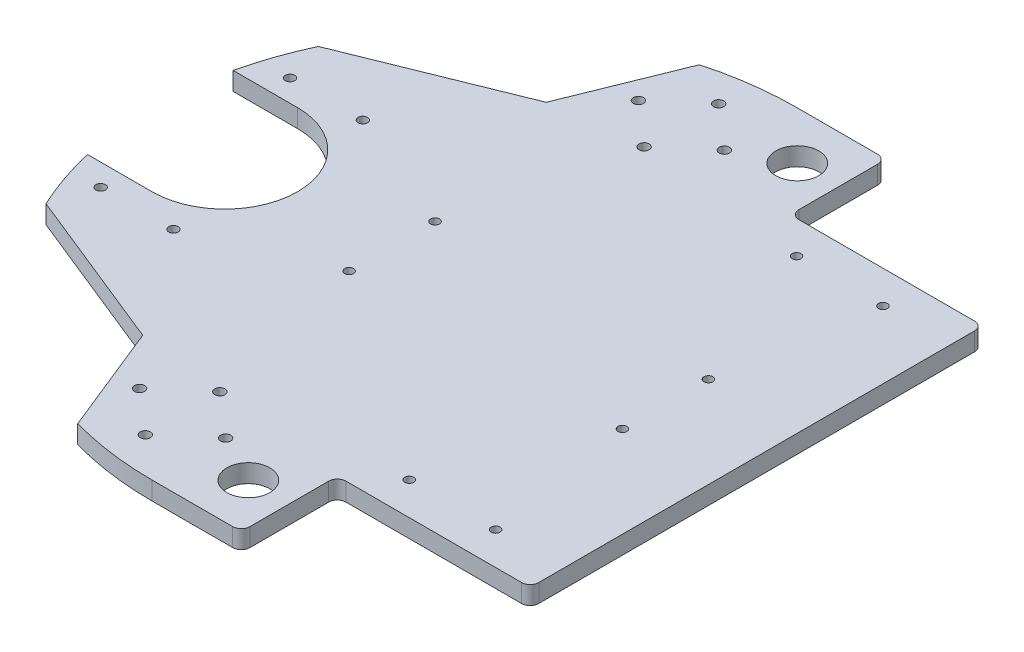
from build123d import *

# Parameters (mm, degrees)
BOSS_EXTRUDE1_DEPTH = 6.35
SKETCH8_R           = 1.651
CUT_EXTRUDE5_DEPTH  = 162.484606465
CUT_EXTRUDE6_DEPTH  = 160.416662013
SKETCH16_R          = 1.775
CUT_EXTRUDE9_DEPTH  = 160.416662013
SKETCH17_R          = 1.55
SKETCH17_R_2        = 7.5
SKETCH17_W          = 67.26995632
SKETCH17_H          = 33.5
CUT_EXTRUDE10_DEPTH = 160.416662013
FILLET1_R           = 3
SKETCH18_R          = 1.55
CUT_EXTRUDE11_DEPTH = 160.416662013


with BuildPart() as part:
    # Sketch1 → Boss-Extrude1 (new body)
    with BuildSketch(Plane(origin=(0, 0, 0), x_dir=(1, 0, 0), z_dir=(0, 1, 0))):
        with BuildLine():
            Line((-3.175, 112.5), (95.25, 112.5))
            Line((95.25, 112.5), (95.25, -112.5))
            Line((95.25, -112.5), (-3.175, -112.5))
            ThreePointArc((-3.175, -112.5), (-115.675, 0), (-3.175, 112.5))
        make_face()
    extrude(amount=-BOSS_EXTRUDE1_DEPTH)

    # Sketch8 → Cut-Extrude5 (cut, through all)
    with BuildSketch(Plane(origin=(0, 0, 0), x_dir=(1, 0, 0), z_dir=(0, 1, 0))):
        with Locations(Location((-100.5586, 33.02, 0), (0, 0, 270))):
            Circle(SKETCH8_R)
        with Locations(Location((-100.5586, -33.02, 0), (0, 0, 270))):
            Circle(SKETCH8_R)
        with Locations(Location((-75.1586, 33.02, 0), (0, 0, 270))):
            Circle(SKETCH8_R)
        with Locations(Location((-75.1586, -33.02, 0), (0, 0, 270))):
            Circle(SKETCH8_R)
        with BuildLine():
            Line((-90.2716, 25.4), (-229.776686608, 25.4))
            Line((-229.776686608, 25.4), (-229.776686608, -25.4))
            Line((-229.776686608, -25.4), (-90.2716, -25.4))
            ThreePointArc((-90.2716, -25.4), (-64.8716, 0), (-90.2716, 25.4))
        make_face()
    extrude(amount=-CUT_EXTRUDE5_DEPTH, mode=Mode.SUBTRACT)

    # Sketch9 → Cut-Extrude6 (cut, through all)
    with BuildSketch(Plane(origin=(0, 0, 0), x_dir=(1, 0, 0), z_dir=(0, 1, 0))):
        Polygon((-105.15131959, 47.508738596), (-48.53191541, 70.384462776), (-12.279886537, 160.111382848), (-19.546794421, 160.111382848), (-135.640402248, 160.111382848), (-135.640402248, 47.508738596), align=None)
        Polygon((-105.15131959, -47.508738596), (-48.53191541, -70.384462776), (-12.279886537, -160.111382848), (-135.640402248, -160.111382848), (-135.640402248, -47.508738596), align=None)
    extrude(amount=-CUT_EXTRUDE6_DEPTH, mode=Mode.SUBTRACT)

    # Sketch16 → Cut-Extrude9 (cut, through all)
    with BuildSketch(Plane(origin=(0, 0, 0), x_dir=(1, 0, 0), z_dir=(0, 1, 0))):
        with Locations(Location((-33, -87, 0), (0, 0, 270))):
            Circle(SKETCH16_R)
        with Locations(Location((-18, -100, 0), (0, 0, 270))):
            Circle(SKETCH16_R)
        with Locations(Location((-18, -74, 0), (0, 0, 270))):
            Circle(SKETCH16_R)
        with Locations(Location((-3, -87, 0), (0, 0, 270))):
            Circle(SKETCH16_R)
        with Locations(Location((-33, 87, 0), (0, 0, 270))):
            Circle(SKETCH16_R)
        with Locations(Location((-18, 100, 0), (0, 0, 270))):
            Circle(SKETCH16_R)
        with Locations(Location((-18, 74, 0), (0, 0, 270))):
            Circle(SKETCH16_R)
        with Locations(Location((-3, 87, 0), (0, 0, 270))):
            Circle(SKETCH16_R)
    extrude(amount=-CUT_EXTRUDE9_DEPTH, mode=Mode.SUBTRACT)

    # Sketch17 → Cut-Extrude10 (cut, through all)
    with BuildSketch(Plane(origin=(0, 0, 0), x_dir=(1, 0, 0), z_dir=(0, 1, 0))):
        with Locations(Location((41.62, 67.558247154, 0), (0, 0, 270))):
            Circle(SKETCH17_R)
        with Locations(Location((71.75, 67.558247154, 0), (0, 0, 270))):
            Circle(SKETCH17_R)
        with Locations(Location((41.62, -67.558247154, 0), (0, 0, 270))):
            Circle(SKETCH17_R)
        with Locations(Location((71.75, -67.558247154, 0), (0, 0, 270))):
            Circle(SKETCH17_R)
        with Locations(Location((13.687276501, 95.75, 0), (0, 0, 270))):
            Circle(SKETCH17_R_2)
        with Locations(Location((13.687276501, -95.75, 0), (0, 0, 270))):
            Circle(SKETCH17_R_2)
        with Locations((61.61502184, 95.75)):
            Rectangle(SKETCH17_W, SKETCH17_H)
        with Locations((61.61502184, -95.75)):
            Rectangle(SKETCH17_W, SKETCH17_H)
    extrude(amount=-CUT_EXTRUDE10_DEPTH, mode=Mode.SUBTRACT)

    # Fillet1
    fillet1_edges = [part.edges().sort_by_distance(p)[0] for p in [
        (95.25, -3.175, -79),
        (27.98004368, -3.175, -79),
        (27.98004368, -3.175, -112.5),
        (95.25, -3.175, 79),
        (27.98004368, -3.175, 112.5),
        (27.98004368, -3.175, 79),
    ]]
    fillet(fillet1_edges, radius=FILLET1_R)

    # Sketch18 → Cut-Extrude11 (cut, through all)
    with BuildSketch(Plane(origin=(0, 0, 0), x_dir=(1, 0, 0), z_dir=(0, 1, 0))):
        with Locations(Location((-31.919429563, 15, 0), (0, 0, 270))):
            Circle(SKETCH18_R)
        with Locations(Location((-31.919429563, -15, 0), (0, 0, 270))):
            Circle(SKETCH18_R)
        with Locations(Location((63.440570437, 15, 0), (0, 0, 270))):
            Circle(SKETCH18_R)
        with Locations(Location((63.440570437, -15, 0), (0, 0, 270))):
            Circle(SKETCH18_R)
    extrude(amount=-CUT_EXTRUDE11_DEPTH, mode=Mode.SUBTRACT)


solid = part.part
